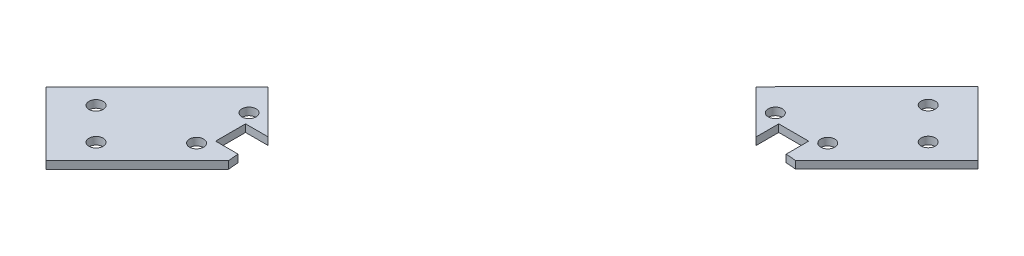
from build123d import *

# Parameters (mm, degrees)
SKETCH1_R           = 1.5
SKETCH1_R_2         = 55
BOSS_EXTRUDE1_DEPTH = 1.5875
CUT_EXTRUDE3_DEPTH  = 140.70900378
CUT_EXTRUDE4_START  = -10
SKETCH3_R           = 1.5
CUT_EXTRUDE4_DEPTH  = 10
CUT_EXTRUDE5_DEPTH  = 140.70900378
CUT_EXTRUDE6_DEPTH  = 140.70900378
SKETCH6_R           = 1.5
CUT_EXTRUDE7_DEPTH  = 124.922732295


with BuildPart() as part:
    # Sketch1 → Boss-Extrude1 (new body)
    with BuildSketch(Plane(origin=(0, 0, 0), x_dir=(1, 0, 0), z_dir=(0, 1, 0))):
        Polygon((0.047005036, -98.782806148), (-98.782806148, -0.047005036), (-0.047005036, 98.782806148), (98.782806148, 0.047005036), align=None)
        with Locations(Location((-61.346730494, 5.55625, 0), (0, 0, 270))):
            Circle(SKETCH1_R, mode=Mode.SUBTRACT)
        with Locations(Location((-61.346730494, -5.55625, 0), (0, 0, 270))):
            Circle(SKETCH1_R, mode=Mode.SUBTRACT)
        with Locations(Location((-5.55625, -61.346730494, 0), (0, 0, 270))):
            Circle(SKETCH1_R, mode=Mode.SUBTRACT)
        with Locations(Location((5.55625, -61.346730494, 0), (0, 0, 270))):
            Circle(SKETCH1_R, mode=Mode.SUBTRACT)
        with Locations(Location((61.346730494, -5.55625, 0), (0, 0, 270))):
            Circle(SKETCH1_R, mode=Mode.SUBTRACT)
        with Locations(Location((61.346730494, 5.55625, 0), (0, 0, 270))):
            Circle(SKETCH1_R, mode=Mode.SUBTRACT)
        with Locations(Location((5.55625, 61.346730494, 0), (0, 0, 270))):
            Circle(SKETCH1_R, mode=Mode.SUBTRACT)
        with Locations(Location((-5.55625, 61.346730494, 0), (0, 0, 270))):
            Circle(SKETCH1_R, mode=Mode.SUBTRACT)
        with Locations(Location((0, 0, 0), (0, 0, 270))):
            Circle(SKETCH1_R_2, mode=Mode.SUBTRACT)
    extrude(amount=BOSS_EXTRUDE1_DEPTH)

    # Sketch2 → Cut-Extrude3 (cut, through all)
    with BuildSketch(Plane(origin=(0, 1.5875, 0), x_dir=(1, 0, 0), z_dir=(0, 1, 0))):
        Polygon((3.175, 53.34), (3.175, 59.69), (-3.175, 59.69), (-3.175, 53.34), (-3.175, 52.244537665), (3.175, 52.244537665), align=None)
        Polygon((53.34, -3.175), (59.69, -3.175), (59.69, 3.175), (53.34, 3.175), (52.244537665, 3.175), (52.244537665, -3.175), align=None)
        Polygon((-3.175, -53.34), (-3.175, -59.69), (3.175, -59.69), (3.175, -53.34), (3.175, -52.244537665), (-3.175, -52.244537665), align=None)
        Polygon((-53.34, 3.175), (-59.69, 3.175), (-59.69, -3.175), (-53.34, -3.175), (-52.244537665, -3.175), (-52.244537665, 3.175), align=None)
    extrude(amount=-CUT_EXTRUDE3_DEPTH, mode=Mode.SUBTRACT)

    # Sketch3 → Cut-Extrude4 (cut)
    # profile 1 of 3: a face of its own
    with BuildSketch(Plane(origin=(0, 1.5875, 0), x_dir=(1, 0, 0), z_dir=(0, 1, 0)).offset(CUT_EXTRUDE4_START)):
        with BuildLine():
            Line((38.872362643, 38.909374482), (49.367900556, 49.414905592))
            Line((49.367900556, 49.414905592), (24.66044776, 74.09885587))
            Line((24.66044776, 74.09885587), (5.321919094, 54.741914263))
            ThreePointArc((5.321919094, 54.741914263), (23.472344653, 49.739813394), (38.872362643, 38.909374482))
        make_face()
    # profile 2 of 3: a face of its own
    with BuildSketch(Plane(origin=(0, 1.5875, 0), x_dir=(1, 0, 0), z_dir=(0, 1, 0)).offset(CUT_EXTRUDE4_START)):
        with BuildLine():
            Line((-49.367900556, -49.414905592), (-38.872362643, -38.909374482))
            ThreePointArc((-38.872362643, -38.909374482), (-49.717452606, -23.519670626), (-54.736824686, -5.374013707))
            Line((-54.736824686, -5.374013707), (-74.075353352, -24.730955314))
            Line((-74.075353352, -24.730955314), (-49.367900556, -49.414905592))
        make_face()
    # profile 3 of 3: a face of its own
    with BuildSketch(Plane(origin=(0, 1.5875, 0), x_dir=(1, 0, 0), z_dir=(0, 1, 0)).offset(CUT_EXTRUDE4_START)):
        with BuildLine():
            Line((98.782806148, 0.047005036), (49.367900556, 49.414905592))
            Line((49.367900556, 49.414905592), (38.872362643, 38.909374482))
            ThreePointArc((38.872362643, 38.909374482), (50.179066182, 22.518022052), (54.908281479, 3.175))
            Line((54.908281479, 3.175), (59.69, 3.175))
            Line((59.69, 3.175), (59.69, -3.175))
            Line((59.69, -3.175), (54.908281479, -3.175))
            ThreePointArc((54.908281479, -3.175), (38.890872965, -38.890872965), (3.175, -54.908281479))
            Line((3.175, -54.908281479), (3.175, -59.69))
            Line((3.175, -59.69), (-3.175, -59.69))
            Line((-3.175, -59.69), (-3.175, -54.908281479))
            ThreePointArc((-3.175, -54.908281479), (-22.494142184, -50.189775527), (-38.872362643, -38.909374482))
            Line((-38.872362643, -38.909374482), (-49.367900556, -49.414905592))
            Line((-49.367900556, -49.414905592), (0.047005036, -98.782806148))
            Line((0.047005036, -98.782806148), (98.782806148, 0.047005036))
        make_face()
        with Locations((-5.55625, -61.346730494)):
            Circle(SKETCH3_R, mode=Mode.SUBTRACT)
        with Locations((5.55625, -61.346730494)):
            Circle(SKETCH3_R, mode=Mode.SUBTRACT)
        with Locations((61.346730494, -5.55625)):
            Circle(SKETCH3_R, mode=Mode.SUBTRACT)
        with Locations((61.346730494, 5.55625)):
            Circle(SKETCH3_R, mode=Mode.SUBTRACT)
    extrude(amount=CUT_EXTRUDE4_DEPTH, mode=Mode.SUBTRACT)

    # Sketch4 → Cut-Extrude5 (cut, through all)
    with BuildSketch(Plane(origin=(0, 1.5875, 0), x_dir=(1, 0, 0), z_dir=(0, 1, 0))):
        Polygon((-54.908281479, 3.175), (-75.255419375, 23.502783048), (-23.546766486, 75.260669691), (-3.175, 54.908281479), align=None)
    extrude(amount=-CUT_EXTRUDE5_DEPTH, mode=Mode.SUBTRACT)


with BuildPart() as cut_extrude5_piece_1:
    # of the separate pieces the step leaves, piece 1, a body of its own (cut_extrude5_pieces)
    add(part.part.solids().sort_by_distance((-74.075353352, 0, 24.730955314))[0])


with BuildPart() as cut_extrude5_piece_2:
    # of the separate pieces the step leaves, piece 2, a body of its own (cut_extrude5_pieces)
    add(part.part.solids().sort_by_distance((-3.175, 0, -54.908281479))[0])


with BuildPart() as cut_extrude6_tool:
    # Sketch5 → Cut-Extrude6 (new, through all)
    with BuildSketch(Plane(origin=(0, 1.5875, 0), x_dir=(1, 0, 0), z_dir=(0, 1, 0))):
        Polygon((-0.047005036, 98.782806148), (11.121699276, 87.624725864), (-87.614101836, -11.205085321), (-98.782806148, -0.047005036), align=None)
    extrude(amount=-CUT_EXTRUDE6_DEPTH)


with BuildPart() as cut_extrude5_piece_1_1:
    add(cut_extrude5_piece_1.part)

    # Cut-Extrude6: cut by cut_extrude6_tool
    add(cut_extrude6_tool.part, mode=Mode.SUBTRACT)


with BuildPart() as cut_extrude5_piece_2_1:
    add(cut_extrude5_piece_2.part)

    # Cut-Extrude6: cut by cut_extrude6_tool
    add(cut_extrude6_tool.part, mode=Mode.SUBTRACT)


with BuildPart() as cut_extrude7_tool:
    # Sketch6 → Cut-Extrude7 (new, through all)
    with BuildSketch(Plane(origin=(0, 1.5875, 0), x_dir=(1, 0, 0), z_dir=(0, 1, 0))):
        with BuildLine():
            ThreePointArc((-73.220428508, -14.983508678), (-73.219419094, -17.104828781), (-71.09809899, -17.103819368))
            Line((-71.09809899, -17.103819368), (-73.220428508, -14.983508678))
        make_face()
        with BuildLine():
            Line((-73.220428508, -14.983508678), (-71.09809899, -17.103819368))
            ThreePointArc((-71.09809899, -17.103819368), (-70.773307917, -16.617359439), (-70.659263749, -16.043664023))
            ThreePointArc((-70.659263749, -16.043664023), (-71.585568332, -14.657708191), (-73.220428508, -14.983508678))
        make_face()
        with BuildLine():
            ThreePointArc((-79.989802749, -8.220573681), (-79.988793336, -10.341893785), (-77.867473232, -10.340884371))
            Line((-77.867473232, -10.340884371), (-79.989802749, -8.220573681))
        make_face()
        with BuildLine():
            Line((-79.989802749, -8.220573681), (-77.867473232, -10.340884371))
            ThreePointArc((-77.867473232, -10.340884371), (-77.542682159, -9.854424443), (-77.428637991, -9.280729026))
            ThreePointArc((-77.428637991, -9.280729026), (-78.354942574, -7.894773194), (-79.989802749, -8.220573681))
        make_face()
        with Locations(Location((16.002609239, 72.202151202, 0), (0, 0, 270))):
            Circle(SKETCH6_R)
        with Locations(Location((9.233234997, 78.965086199, 0), (0, 0, 270))):
            Circle(SKETCH6_R)
    extrude(amount=-CUT_EXTRUDE7_DEPTH)


with BuildPart() as cut_extrude5_piece_1_2:
    add(cut_extrude5_piece_1_1.part)

    # Cut-Extrude7: cut by cut_extrude7_tool
    add(cut_extrude7_tool.part, mode=Mode.SUBTRACT)


with BuildPart() as cut_extrude5_piece_2_2:
    add(cut_extrude5_piece_2_1.part)

    # Cut-Extrude7: cut by cut_extrude7_tool
    add(cut_extrude7_tool.part, mode=Mode.SUBTRACT)


solid = Compound([cut_extrude5_piece_1_2.part, cut_extrude5_piece_2_2.part])
